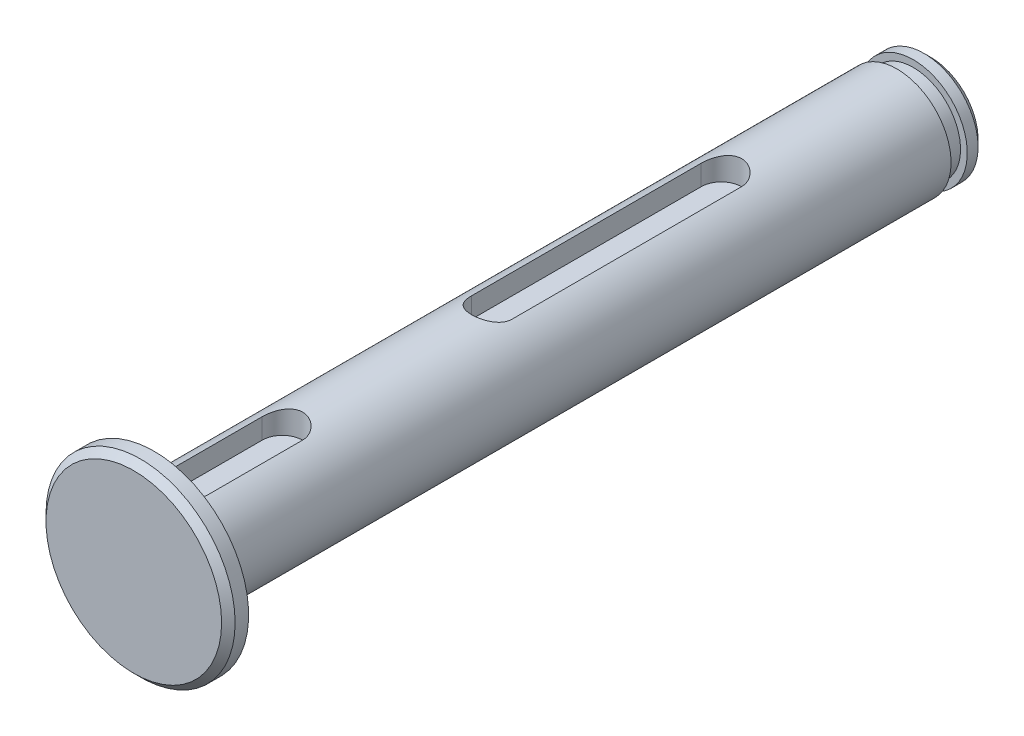
from build123d import *

# Parameters (mm, degrees)
CHAMFER1_SIZE      = 0.5
CUT_EXTRUDE1_DEPTH = 10
EXTRUDE1_DEPTH     = 2.2
EXTRUDE2_DEPTH     = 2.2


with BuildPart() as part:
    # Sketch1 → Revolve1 (revolve)
    with BuildSketch(Plane(origin=(0, 0, 0), x_dir=(1, 0, 0), z_dir=(0, 1, 0))):
        Polygon((0, -57.7), (-7, -57.7), (-7, -56.2), (-4, -56.2), (-4, -19.947651257), (-4, -1.2), (-3.5, -1.2), (-3.5, 0), (-4, 0), (-4, 1.3), (0, 1.3), align=None)
    revolve(axis=Axis((0, 0, -49.376724138), (0, 0, 1)))

    # Chamfer1
    chamfer1_edges = [part.edges().sort_by_distance(p)[0] for p in [
        (4, 0, -1.3),
        (7, 0, 57.7),
    ]]
    chamfer(chamfer1_edges, length=CHAMFER1_SIZE)

    # Sketch2 → Cut-Extrude1 (cut)
    with BuildSketch(Plane(origin=(0, 0, 0), x_dir=(1, 0, 0), z_dir=(0, 1, 0))):
        with BuildLine():
            Line((-1.5, -14.2), (-1.5, -31.2))
            ThreePointArc((-1.5, -31.2), (0, -32.7), (1.5, -31.2))
            Line((1.5, -31.2), (1.5, -14.2))
            ThreePointArc((1.5, -14.2), (0, -12.7), (-1.5, -14.2))
        make_face()
        with BuildLine():
            Line((-1.5, -46.7), (-1.5, -53.7))
            ThreePointArc((-1.5, -53.7), (0, -55.2), (1.5, -53.7))
            Line((1.5, -53.7), (1.5, -46.7))
            ThreePointArc((1.5, -46.7), (0, -45.2), (-1.5, -46.7))
        make_face()
    extrude(amount=CUT_EXTRUDE1_DEPTH, mode=Mode.SUBTRACT)

    # Sketch3 → Extrude1 (add)
    with BuildSketch(Plane(origin=(0, 0, 0), x_dir=(1, 0, 0), z_dir=(0, 1, 0))):
        with BuildLine():
            Line((1.5, -31.2), (1.5, -14.2))
            ThreePointArc((1.5, -14.2), (0, -12.7), (-1.5, -14.2))
            Line((-1.5, -14.2), (-1.5, -31.2))
            ThreePointArc((-1.5, -31.2), (0, -32.7), (1.5, -31.2))
        make_face()
    extrude(amount=EXTRUDE1_DEPTH)

    # Sketch4 → Extrude2 (add)
    with BuildSketch(Plane(origin=(0, 0, 0), x_dir=(1, 0, 0), z_dir=(0, 1, 0))):
        with BuildLine():
            Line((-1.5, -46.7), (-1.5, -53.7))
            ThreePointArc((-1.5, -53.7), (0, -55.2), (1.5, -53.7))
            Line((1.5, -53.7), (1.5, -46.7))
            ThreePointArc((1.5, -46.7), (0, -45.2), (-1.5, -46.7))
        make_face()
    extrude(amount=EXTRUDE2_DEPTH)


solid = part.part
